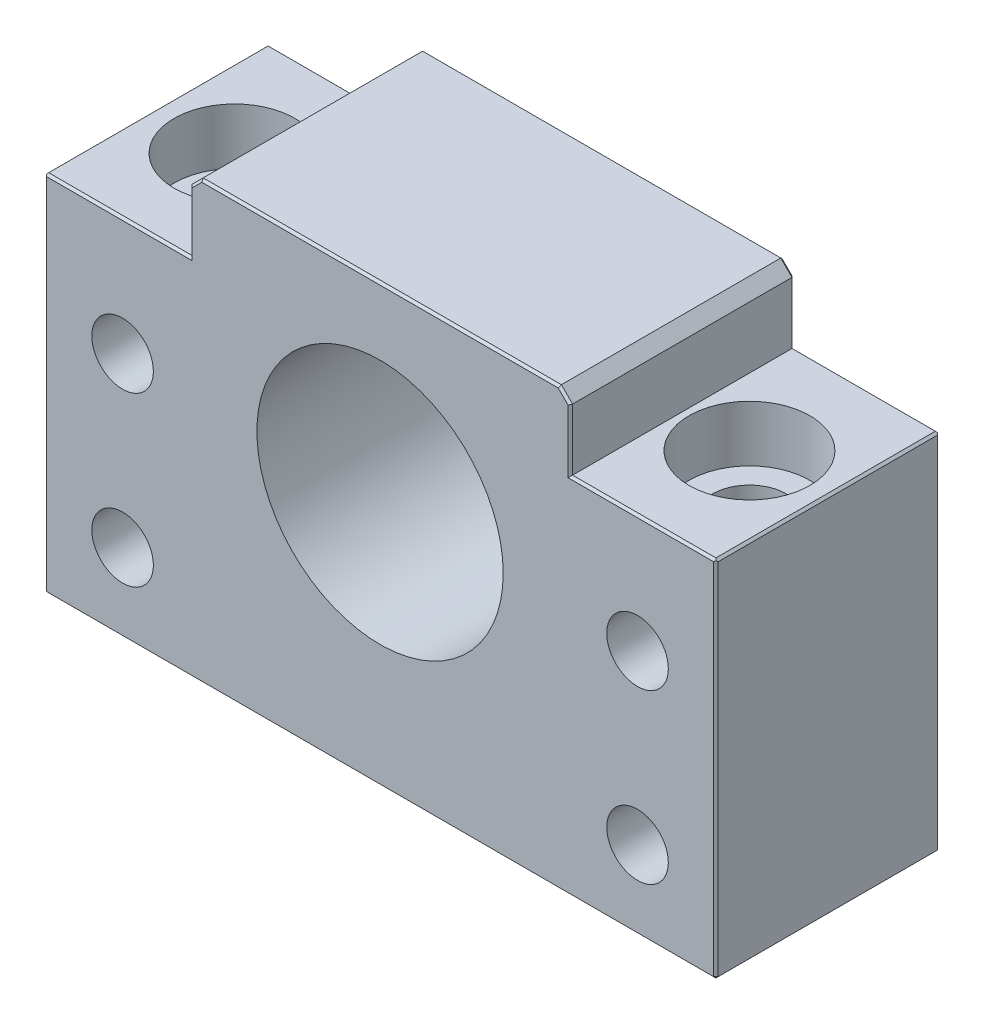
from build123d import *

# Parameters (mm, degrees)
SKETCH_1_W          = 60
SKETCH_1_H          = 32.5
EXTRUDE_1_DEPTH     = 20
SKETCH_2_W          = 34
SKETCH_2_H          = 20
EXTRUDE_2_DEPTH     = 6.5
SKETCH_3_R          = 5.4
CUT_EXTRUDE_1_DEPTH = 5
SKETCH_4_R          = 3.3
CUT_EXTRUDE_2_DEPTH = 46.345892868
SKETCH_7_R          = 2.75
CUT_EXTRUDE_3_DEPTH = 43.632880503
SKETCH_8_R          = 11
CUT_EXTRUDE_4_DEPTH = 35
CHAMFER_1_SIZE      = 1
CHAMFER_2_SIZE      = 0.2
CHAMFER_3_SIZE      = 0.2


with BuildPart() as part:
    # 草图1 → 凸台-拉伸1 (new body)
    with BuildSketch(Plane.XY):
        Rectangle(SKETCH_1_W, SKETCH_1_H)
    extrude(amount=EXTRUDE_1_DEPTH)

    # 草图2 → 凸台-拉伸2 (add)
    with BuildSketch(Plane(origin=(0, 16.25, 0), x_dir=(1, 0, 0), z_dir=(0, 1, 0))):
        with Locations((0, -10)):
            Rectangle(SKETCH_2_W, SKETCH_2_H)
    extrude(amount=EXTRUDE_2_DEPTH)

    # 草图3 → 切除-拉伸1 (cut)
    with BuildSketch(Plane(origin=(0, 16.25, 0), x_dir=(1, 0, 0), z_dir=(0, 1, 0))):
        with Locations(Location((-23, -10, 0), (0, 0, 270))):
            Circle(SKETCH_3_R)
        with Locations(Location((23, -10, 0), (0, 0, 270))):
            Circle(SKETCH_3_R)
    extrude(amount=-CUT_EXTRUDE_1_DEPTH, mode=Mode.SUBTRACT)

    # 草图4 → 切除-拉伸2 (cut, through all)
    with BuildSketch(Plane(origin=(0, 11.25, 0), x_dir=(1, 0, 0), z_dir=(0, 1, 0))):
        with Locations(Location((-23, -10, 0), (0, 0, 270))):
            Circle(SKETCH_4_R)
        with Locations(Location((23, -10, 0), (0, 0, 270))):
            Circle(SKETCH_4_R)
    extrude(amount=-CUT_EXTRUDE_2_DEPTH, mode=Mode.SUBTRACT)

    # 草图7 → 切除-拉伸3 (cut, through all)
    with BuildSketch(Plane.XY.offset(20)):
        with Locations((-23, 5.75)):
            Circle(SKETCH_7_R)
        with Locations((23, 5.75)):
            Circle(SKETCH_7_R)
        with Locations((-23, -9.25)):
            Circle(SKETCH_7_R)
        with Locations((23, -9.25)):
            Circle(SKETCH_7_R)
    extrude(amount=-CUT_EXTRUDE_3_DEPTH, mode=Mode.SUBTRACT)

    # 草图8 → 切除-拉伸4 (cut)
    with BuildSketch(Plane.XY.offset(20)):
        with Locations((0, 5.75)):
            Circle(SKETCH_8_R)
    extrude(amount=-CUT_EXTRUDE_4_DEPTH, mode=Mode.SUBTRACT)

    # 倒角1
    chamfer_1_edges = [part.edges().sort_by_distance(p)[0] for p in [
        (17, 22.75, 10),
        (-17, 22.75, 10),
    ]]
    chamfer(chamfer_1_edges, length=CHAMFER_1_SIZE)

    # 倒角2
    chamfer_2_edges = [part.edges().sort_by_distance(p)[0] for p in [
        (-16.5, 22.25, 0),
        (-17, 19, 0),
        (-23.5, 16.25, 0),
        (0, 22.75, 0),
        (16.5, 22.25, 0),
        (17, 19, 0),
        (23.5, 16.25, 0),
        (30, 16.25, 10),
        (23.5, 16.25, 20),
        (17, 19, 20),
        (16.5, 22.25, 20),
        (0, 22.75, 20),
        (-16.5, 22.25, 20),
        (-17, 19, 20),
        (-23.5, 16.25, 20),
        (-30, 16.25, 10),
    ]]
    chamfer(chamfer_2_edges, length=CHAMFER_2_SIZE)

    # 倒角3
    chamfer_3_edges = [part.edges().sort_by_distance(p)[0] for p in [
        (-30, -0.1, 0),
        (-30, -0.1, 20),
        (0, -16.25, 20),
        (30, -0.1, 20),
        (0, -16.25, 0),
        (30, -0.1, 0),
        (30, -16.25, 10),
        (-30, -16.25, 10),
    ]]
    chamfer(chamfer_3_edges, length=CHAMFER_3_SIZE)


solid = part.part
